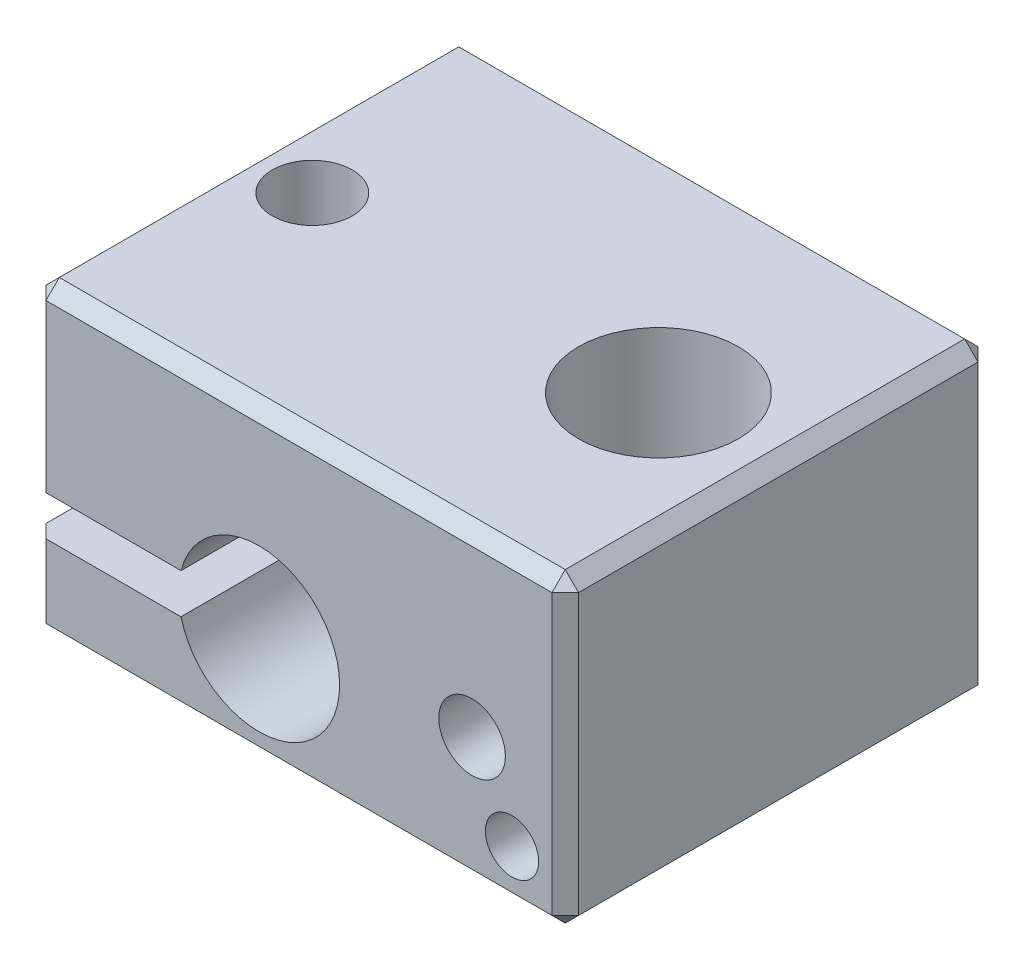
from build123d import *

# Parameters (mm, degrees)
AUFSATZ_LINEAR_AUSTRAGEN1_DEPTH      = 16
SCHNITT_LINEAR_AUSTRAGEN1_REACH      = 30.076
SKIZZE2_R                            = 1.5
SKIZZE2_R_2                          = 3
M3_GEWINDEBOHRUNG1_D                 = 2.5
M3_GEWINDEBOHRUNG1_DEPTH             = 3
M3_GEWINDEBOHRUNG1_TIP               = 0.751075774
F_1_5_1_5_DURCHMESSER_BOHRUNG1_D     = 1.5
F_1_5_1_5_DURCHMESSER_BOHRUNG1_DEPTH = 4
F_1_5_1_5_DURCHMESSER_BOHRUNG1_TIP   = 0.450645464
F_2_0_2_DURCHMESSER_BOHRUNG1_D       = 2
F_2_0_2_DURCHMESSER_BOHRUNG1_DEPTH   = 2
F_2_0_2_DURCHMESSER_BOHRUNG1_TIP     = 0.600860619
FASE1_SIZE                           = 0.5


with BuildPart() as part:
    # Skizze1 → Aufsatz-Linear austragen1 (new body)
    with BuildSketch(Plane.XY):
        with BuildLine():
            Line((-20, 4.75), (-14.43055029, 4.75))
            ThreePointArc((-14.43055029, 4.75), (-8.475, 4), (-14.43055029, 3.25))
            Line((-14.43055029, 3.25), (-20, 3.25))
            Line((-20, 3.25), (-20, 0))
            Line((-20, 0), (0, 0))
            Line((0, 0), (0, 11.5))
            Line((0, 11.5), (-20, 11.5))
            Line((-20, 11.5), (-20, 4.75))
        make_face()
    extrude(amount=AUFSATZ_LINEAR_AUSTRAGEN1_DEPTH)

    # Schnitt-Linear austragen1: up to this face of the body (flat: up to its plane)
    schnitt_linear_austragen1_end = Plane(part.part.faces().sort_by_distance((-10, 0, 8))[0])
    # Skizze2 → Schnitt-Linear austragen1 (cut, up to the picked face)
    with BuildSketch(Plane(origin=(0, 11.5, 0), x_dir=(1, 0, 0), z_dir=(0, 1, 0)), mode=Mode.PRIVATE) as schnitt_linear_austragen1_sk1:
        with Locations(Location((-17.5, -8, 0), (0, 0, 180))):
            Circle(SKIZZE2_R)
    schnitt_linear_austragen1_tool1 = split(extrude(schnitt_linear_austragen1_sk1.sketch, amount=-SCHNITT_LINEAR_AUSTRAGEN1_REACH, mode=Mode.PRIVATE), bisect_by=schnitt_linear_austragen1_end, keep=Keep.BOTH, mode=Mode.PRIVATE)
    # Skizze2 → Schnitt-Linear austragen1 (cut, up to the picked face)
    with BuildSketch(Plane(origin=(0, 11.5, 0), x_dir=(1, 0, 0), z_dir=(0, 1, 0)), mode=Mode.PRIVATE) as schnitt_linear_austragen1_sk2:
        with Locations(Location((-4.5, -8, 0), (0, 0, 180))):
            Circle(SKIZZE2_R_2)
    schnitt_linear_austragen1_tool2 = split(extrude(schnitt_linear_austragen1_sk2.sketch, amount=-SCHNITT_LINEAR_AUSTRAGEN1_REACH, mode=Mode.PRIVATE), bisect_by=schnitt_linear_austragen1_end, keep=Keep.BOTH, mode=Mode.PRIVATE)
    add(schnitt_linear_austragen1_tool1.solids().sort_by(Axis((-17.5, 11.5, 8), (0, -1, 0)))[0], mode=Mode.SUBTRACT)
    add(schnitt_linear_austragen1_tool2.solids().sort_by(Axis((-4.5, 11.5, 8), (0, -1, 0)))[0], mode=Mode.SUBTRACT)

    # M3 Gewindebohrung1
    with Locations(Plane.XY.offset(16)):
        with Locations((-3.5, 4.8)):
            Hole(M3_GEWINDEBOHRUNG1_D / 2, depth=M3_GEWINDEBOHRUNG1_DEPTH)
            with Locations((0, 0, -(M3_GEWINDEBOHRUNG1_DEPTH + M3_GEWINDEBOHRUNG1_TIP / 2))):  # 118° drill point
                Cone(0, M3_GEWINDEBOHRUNG1_D / 2, M3_GEWINDEBOHRUNG1_TIP, mode=Mode.SUBTRACT)

    # Ø1.5 (1.5) Durchmesser Bohrung1
    with Locations(Plane.XY.offset(16)):
        with Locations((-2, 2)):
            Hole(F_1_5_1_5_DURCHMESSER_BOHRUNG1_D / 2, depth=F_1_5_1_5_DURCHMESSER_BOHRUNG1_DEPTH)
            with Locations((0, 0, -(F_1_5_1_5_DURCHMESSER_BOHRUNG1_DEPTH + F_1_5_1_5_DURCHMESSER_BOHRUNG1_TIP / 2))):  # 118° drill point
                Cone(0, F_1_5_1_5_DURCHMESSER_BOHRUNG1_D / 2, F_1_5_1_5_DURCHMESSER_BOHRUNG1_TIP, mode=Mode.SUBTRACT)

    # Ø2.0 (2) Durchmesser Bohrung1
    with Locations(Plane.XY.offset(16)):
        with Locations((-2, 2)):
            Hole(F_2_0_2_DURCHMESSER_BOHRUNG1_D / 2, depth=F_2_0_2_DURCHMESSER_BOHRUNG1_DEPTH)
            with Locations((0, 0, -(F_2_0_2_DURCHMESSER_BOHRUNG1_DEPTH + F_2_0_2_DURCHMESSER_BOHRUNG1_TIP / 2))):  # 118° drill point
                Cone(0, F_2_0_2_DURCHMESSER_BOHRUNG1_D / 2, F_2_0_2_DURCHMESSER_BOHRUNG1_TIP, mode=Mode.SUBTRACT)

    # Fase1
    fase1_edges = [part.edges().sort_by_distance(p)[0] for p in [
        (-20, 8.125, 16),
        (-10, 11.5, 0),
        (0, 5.75, 0),
        (0, 0, 8),
        (-20, 0, 8),
        (-20, 11.5, 8),
        (0, 11.5, 8),
        (-20, 1.625, 16),
        (-10, 0, 16),
        (0, 5.75, 16),
        (-10, 11.5, 16),
        (-10, 0, 0),
        (-20, 1.625, 0),
        (-20, 8.125, 0),
    ]]
    chamfer(fase1_edges, length=FASE1_SIZE)


solid = part.part
